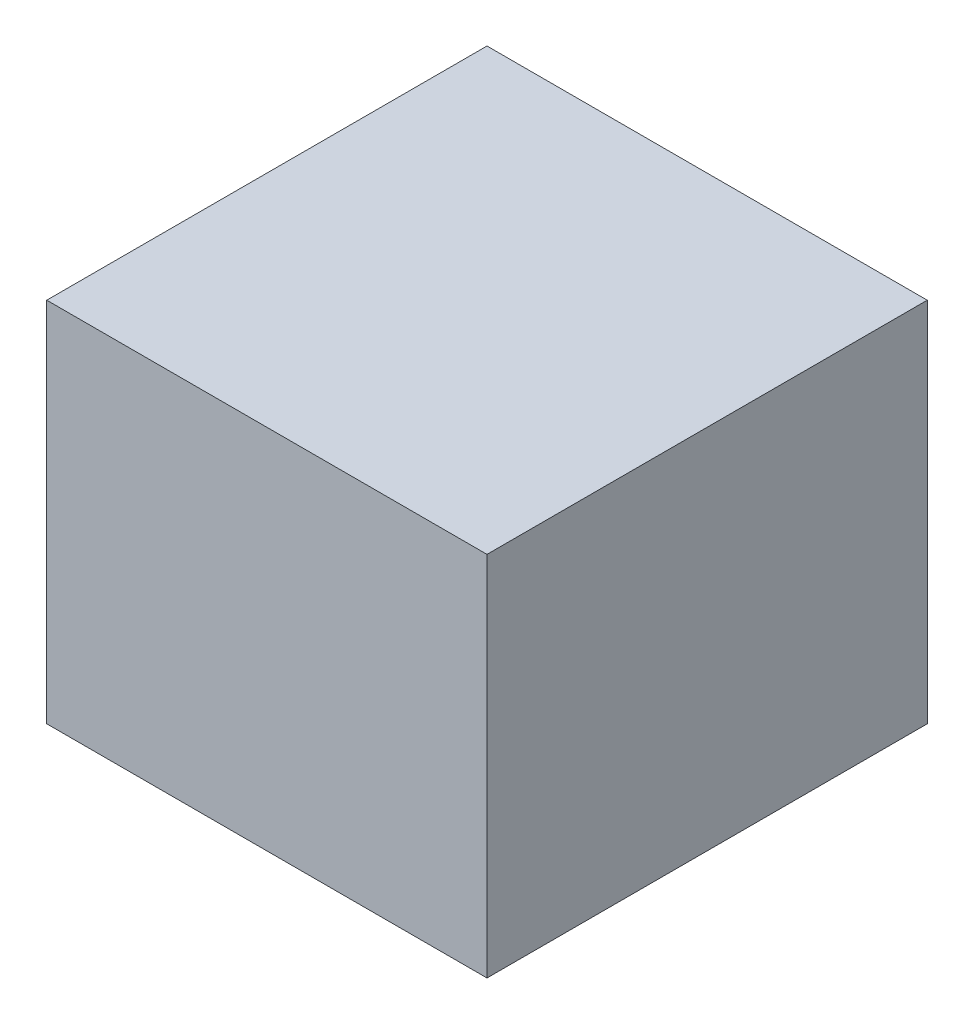
from build123d import *

# Parameters (mm, degrees)
SKETCH1_W           = 300
SKETCH1_H           = 250
BOSS_EXTRUDE1_DEPTH = 300


with BuildPart() as part:
    # Sketch1 → Boss-Extrude1 (new body)
    with BuildSketch(Plane.XY):
        with Locations((118.966009033, 95.905633468)):
            Rectangle(SKETCH1_W, SKETCH1_H)
    extrude(amount=BOSS_EXTRUDE1_DEPTH)


solid = part.part
